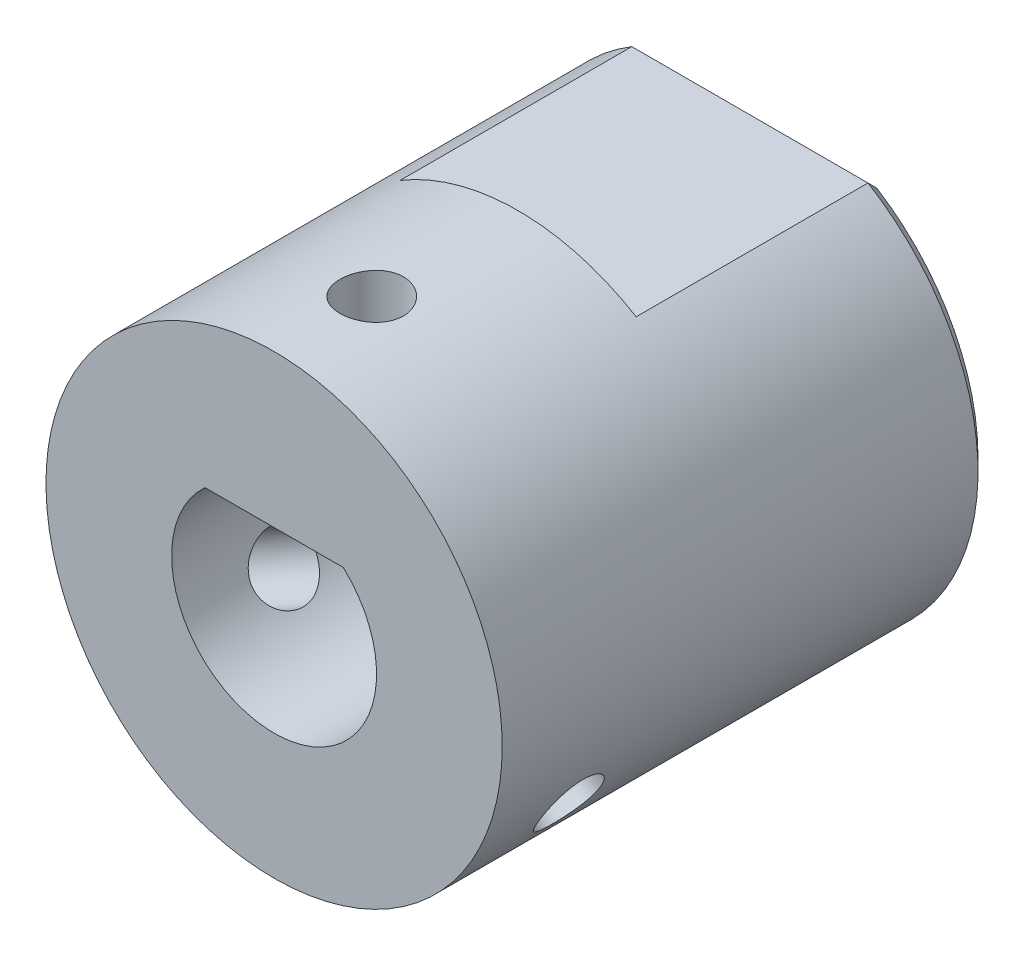
from build123d import *

# Parameters (mm, degrees)
SKETCH_2_R               = 9.35
SKETCH_2_R_2             = 4.2
EXTRUDE_1_DEPTH          = 20
EXTRUDE_START            = -10
EXTRUDE_2_DEPTH          = 10
CUT_EXTRUDE_1_REACH      = 30.933
SKETCH_3_R               = 1.3
PATTERN_CIRCULAR_1_COUNT = 3
CUT_EXTRUDE_2_DEPTH      = 10
CHAMFER_1_SIZE           = 0.5


with BuildPart() as part:
    # Эскиз2 → Бобышка-Вытянуть1 (new body)
    with BuildSketch(Plane.XY):
        Circle(SKETCH_2_R)
        Circle(SKETCH_2_R_2, mode=Mode.SUBTRACT)
    extrude(amount=EXTRUDE_1_DEPTH)

    # Эскиз4 → Бобышка-Вытянуть2 (add)
    with BuildSketch(Plane.XY.offset(20).offset(EXTRUDE_START)):
        with BuildLine():
            Line((-2.833725463, 3.1), (2.833725463, 3.1))
            ThreePointArc((2.833725463, 3.1), (0, 4.2), (-2.833725463, 3.1))
        make_face()
    extrude(amount=EXTRUDE_2_DEPTH)

    # Эскиз3 → Вырез-Вытянуть1 (cut, up to next)
    with BuildSketch(Plane(origin=(0, 9.35, 0), x_dir=(1, 0, 0), z_dir=(0, 1, 0)), mode=Mode.PRIVATE) as cut_extrude_1_sk1:
        with Locations(Location((0, -16, 0), (0, 0, 270))):
            Circle(SKETCH_3_R)
    cut_extrude_1_tool1 = extrude(cut_extrude_1_sk1.sketch, amount=-CUT_EXTRUDE_1_REACH, mode=Mode.PRIVATE) & part.part
    cut_extrude_1 = cut_extrude_1_tool1.solids().sort_by_distance((0, 9.35, 16))[0]
    add(cut_extrude_1, mode=Mode.SUBTRACT)

    # Круговой массив1: Вырез-Вытянуть1 ×3 about axis
    pattern_circular_1_axis = Axis((0, 0, 20), (0, 0, -1))
    for i in range(1, PATTERN_CIRCULAR_1_COUNT):
        add(cut_extrude_1.rotate(pattern_circular_1_axis, i * 360 / PATTERN_CIRCULAR_1_COUNT), mode=Mode.SUBTRACT)

    # Эскиз5 → Вырез-Вытянуть2 (cut)
    with BuildSketch(Plane(origin=(0, 0, 0), x_dir=(-1, 0, 0), z_dir=(0, 0, -1))):
        with BuildLine():
            Line((-4.839679741, 8), (4.839679741, 8))
            ThreePointArc((4.839679741, 8), (0, 9.35), (-4.839679741, 8))
        make_face()
    extrude(amount=-CUT_EXTRUDE_2_DEPTH, mode=Mode.SUBTRACT)

    # Фаска1
    chamfer_1_edges = [part.edges().sort_by_distance(p)[0] for p in [
        (-4.591921951, -8.144737736, 0),
        (0, 8, 0),
    ]]
    chamfer(chamfer_1_edges, length=CHAMFER_1_SIZE)


solid = part.part
